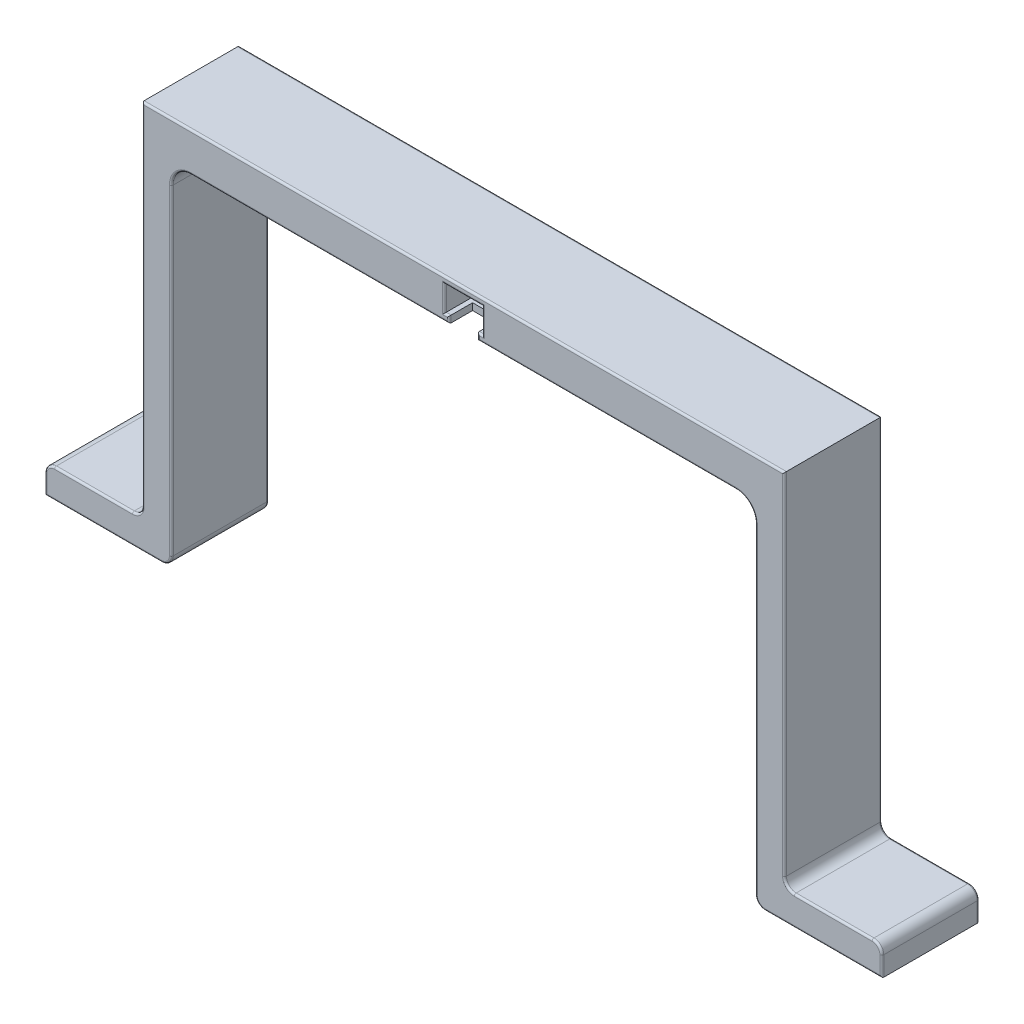
from build123d import *

# Parameters (mm, degrees)
BOSS_EXTRUDE1_DEPTH = 25
SKETCH2_W           = 19.5
SKETCH2_H           = 13
CUT_EXTRUDE1_DEPTH  = 298.867420172
SKETCH3_R           = 2.5
SKETCH3_W           = 14.5
SKETCH3_H           = 12
SKETCH3_H_2         = 27
CUT_EXTRUDE2_DEPTH  = 5
FILLET2_R           = 10
FILLET3_R           = 5
FILLET4_R           = 1


with BuildPart() as part:
    # Sketch1 → Boss-Extrude1 (new, symmetric)
    with BuildSketch(Plane.XY):
        Polygon((-215, 0), (-150, 0), (-150, 180), (150, 180), (150, 0), (215, 0), (215, 15), (165, 15), (165, 195), (165, 200), (150, 200), (-150, 200), (-165, 200), (-165, 195), (-165, 15), (-215, 15), align=None)
    extrude(amount=BOSS_EXTRUDE1_DEPTH, both=True)

    # Sketch2 → Cut-Extrude1 (cut, through all)
    with BuildSketch(Plane.XY.offset(25)):
        with Locations((0, 190)):
            Rectangle(SKETCH2_W, SKETCH2_H)
    extrude(amount=-CUT_EXTRUDE1_DEPTH, mode=Mode.SUBTRACT)

    # Sketch3 → Cut-Extrude2 (cut)
    with BuildSketch(Plane.XZ.offset(-180)):
        with Locations(Location((0, 10, 0), (0, 0, 270))):
            Circle(SKETCH3_R)
        with Locations((0, 19)):
            Rectangle(SKETCH3_W, SKETCH3_H)
        with Locations((0, -6.5)):
            Rectangle(SKETCH3_W, SKETCH3_H_2)
    extrude(amount=-CUT_EXTRUDE2_DEPTH, mode=Mode.SUBTRACT)

    # Fillet2
    fillet2_edges = [part.edges().sort_by_distance(p)[0] for p in [
        (150, 180, 0),
        (-150, 180, 0),
    ]]
    fillet(fillet2_edges, radius=FILLET2_R)

    # Fillet3
    fillet3_edges = [part.edges().sort_by_distance(p)[0] for p in [
        (-215, 15, 0),
        (-165, 15, 0),
        (165, 15, 0),
        (215, 15, 0),
        (150, 0, 0),
        (-150, 0, 0),
    ]]
    fillet(fillet3_edges, radius=FILLET3_R)

    # Fillet4
    fillet4_edges = [part.edges().sort_by_distance(p)[0] for p in [
        (150, 87.5, -25),
        (150, 87.5, 25),
        (-73.625, 180, 25),
        (0, 180, -25),
        (147.071067812, 177.071067812, -25),
        (147.071067812, 177.071067812, 25),
        (-147.071067812, 177.071067812, -25),
        (-147.071067812, 177.071067812, 25),
        (185, 0, -25),
        (185, 0, 25),
        (-215, 5, -25),
        (-190, 15, -25),
        (165, 110, -25),
        (190, 15, -25),
        (-150, 87.5, -25),
        (-213.535533906, 13.535533906, -25),
        (213.535533906, 13.535533906, -25),
        (-151.464466094, 1.464466094, -25),
        (151.464466094, 1.464466094, -25),
        (190, 15, 25),
        (165, 110, 25),
        (-190, 15, 25),
        (-215, 5, 25),
        (-150, 87.5, 25),
        (-213.535533906, 13.535533906, 25),
        (213.535533906, 13.535533906, 25),
        (-151.464466094, 1.464466094, 25),
        (151.464466094, 1.464466094, 25),
        (166.464466094, 16.464466094, -25),
        (166.464466094, 16.464466094, 25),
        (-166.464466094, 16.464466094, -25),
        (-166.464466094, 16.464466094, 25),
        (-165, 110, -25),
        (0, 200, -25),
        (215, 5, -25),
        (-185, 0, -25),
        (215, 5, 25),
        (0, 200, 25),
        (9.75, 190, -25),
        (0, 183.5, -25),
        (-9.75, 190, -25),
        (0, 196.5, -25),
        (9.75, 190, 25),
        (0, 196.5, 25),
        (-9.75, 190, 25),
        (-8.5, 183.5, 25),
        (-165, 110, 25),
        (8.5, 183.5, 25),
        (73.625, 180, 25),
        (-7.25, 181.75, 25),
        (7.25, 181.75, 25),
        (-185, 0, 25),
    ]]
    fillet(fillet4_edges, radius=FILLET4_R)


solid = part.part
